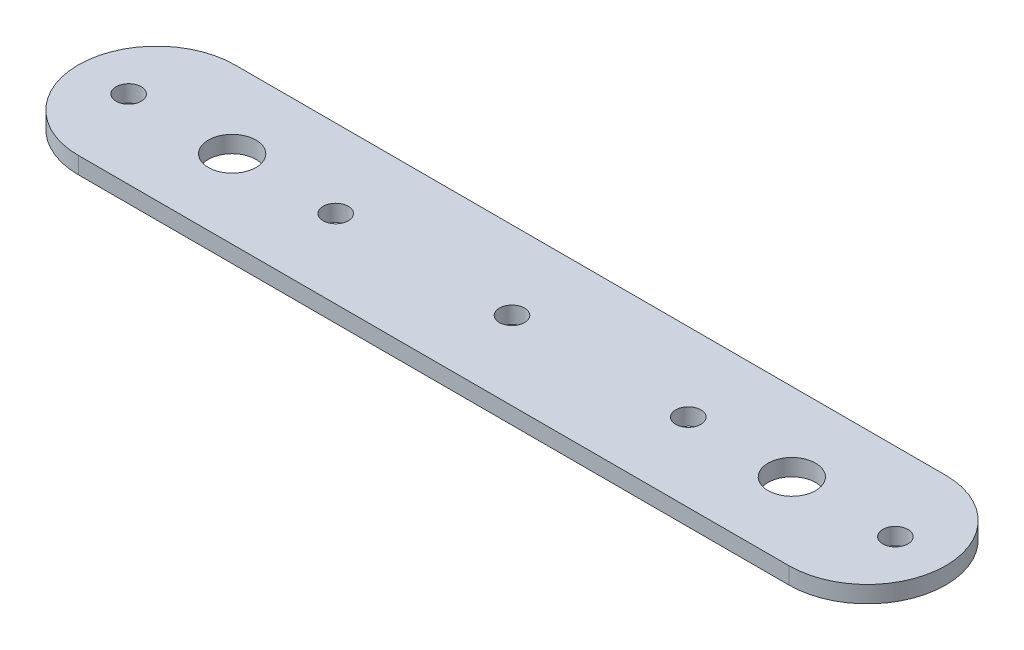
from build123d import *

# Parameters (mm, degrees)
SKETCH_1_W          = 155
SKETCH_1_H          = 28
EXTRUDE_1_DEPTH     = 3
CUT_EXTRUDE_1_REACH = 80.811
SKETCH_2_R          = 4.25
SKETCH_2_R_2        = 2.25
FILLET_1_RADIUS     = 14
FILLET_1_LENGTH     = 3
CUT_EXTRUDE_2_REACH = 80.811
SKETCH_3_R          = 2.25
FILLET_2_RADIUS     = 14
FILLET_2_LENGTH     = 3


with BuildPart() as part:
    # 草图1 → 凸台-拉伸1 (new body)
    with BuildSketch(Plane(origin=(0, 0, 0), x_dir=(1, 0, 0), z_dir=(0, 1, 0))):
        Rectangle(SKETCH_1_W, SKETCH_1_H)
    extrude(amount=EXTRUDE_1_DEPTH)

    # 草图2 → 切除-拉伸1 (cut, up to next)
    with BuildSketch(Plane(origin=(0, 3, 0), x_dir=(1, 0, 0), z_dir=(0, 1, 0)), mode=Mode.PRIVATE) as cut_extrude_1_sk1:
        with Locations(Location((-50, 0, 0), (0, 0, 270))):
            Circle(SKETCH_2_R)
    cut_extrude_1_tool1 = extrude(cut_extrude_1_sk1.sketch, amount=-CUT_EXTRUDE_1_REACH, mode=Mode.PRIVATE) & part.part
    # 草图2 → 切除-拉伸1 (cut, up to next)
    with BuildSketch(Plane(origin=(0, 3, 0), x_dir=(1, 0, 0), z_dir=(0, 1, 0)), mode=Mode.PRIVATE) as cut_extrude_1_sk2:
        with Locations(Location((50, 0, 0), (0, 0, 270))):
            Circle(SKETCH_2_R)
    cut_extrude_1_tool2 = extrude(cut_extrude_1_sk2.sketch, amount=-CUT_EXTRUDE_1_REACH, mode=Mode.PRIVATE) & part.part
    # 草图2 → 切除-拉伸1 (cut, up to next)
    with BuildSketch(Plane(origin=(0, 3, 0), x_dir=(1, 0, 0), z_dir=(0, 1, 0)), mode=Mode.PRIVATE) as cut_extrude_1_sk3:
        with Locations(Location((0, 0, 0), (0, 0, 270))):
            Circle(SKETCH_2_R_2)
    cut_extrude_1_tool3 = extrude(cut_extrude_1_sk3.sketch, amount=-CUT_EXTRUDE_1_REACH, mode=Mode.PRIVATE) & part.part
    add(cut_extrude_1_tool1.solids().sort_by_distance((-50, 3, 0))[0], mode=Mode.SUBTRACT)
    add(cut_extrude_1_tool2.solids().sort_by_distance((50, 3, 0))[0], mode=Mode.SUBTRACT)
    add(cut_extrude_1_tool3.solids().sort_by_distance((0, 3, 0))[0], mode=Mode.SUBTRACT)

    # 圆角1: full round fillet: the end face becomes a half cylinder, R = half its width
    fillet_1_face = Plane((-77.5, 1.5, 0), x_dir=(0, 1, 0), z_dir=(-1, 0, 0))  # on the end face: x along it, z out of the body
    fillet_1_slab = fillet_1_face.offset(-FILLET_1_RADIUS / 2) * Box(FILLET_1_LENGTH, 2 * FILLET_1_RADIUS, FILLET_1_RADIUS, mode=Mode.PRIVATE)  # the body's end, R deep
    fillet_1_round = Plane((-63.5, 1.5, 0), x_dir=(-1, 0, 0), z_dir=(0, 1, 0)) * Cylinder(FILLET_1_RADIUS, FILLET_1_LENGTH, mode=Mode.PRIVATE)  # its axis R under the face
    add(fillet_1_slab - fillet_1_round, mode=Mode.SUBTRACT)

    # 草图3 → 切除-拉伸2 (cut, up to next)
    with BuildSketch(Plane(origin=(0, 3, 0), x_dir=(1, 0, 0), z_dir=(0, 1, 0)), mode=Mode.PRIVATE) as cut_extrude_2_sk1:
        with Locations(Location((-68.5, 0, 0), (0, 0, 270))):
            Circle(SKETCH_3_R)
    cut_extrude_2_tool1 = extrude(cut_extrude_2_sk1.sketch, amount=-CUT_EXTRUDE_2_REACH, mode=Mode.PRIVATE) & part.part
    # 草图3 → 切除-拉伸2 (cut, up to next)
    with BuildSketch(Plane(origin=(0, 3, 0), x_dir=(1, 0, 0), z_dir=(0, 1, 0)), mode=Mode.PRIVATE) as cut_extrude_2_sk2:
        with Locations(Location((-31.5, 0, 0), (0, 0, 270))):
            Circle(SKETCH_3_R)
    cut_extrude_2_tool2 = extrude(cut_extrude_2_sk2.sketch, amount=-CUT_EXTRUDE_2_REACH, mode=Mode.PRIVATE) & part.part
    # 草图3 → 切除-拉伸2 (cut, up to next)
    with BuildSketch(Plane(origin=(0, 3, 0), x_dir=(1, 0, 0), z_dir=(0, 1, 0)), mode=Mode.PRIVATE) as cut_extrude_2_sk3:
        with Locations(Location((31.5, 0, 0), (0, 0, 270))):
            Circle(SKETCH_3_R)
    cut_extrude_2_tool3 = extrude(cut_extrude_2_sk3.sketch, amount=-CUT_EXTRUDE_2_REACH, mode=Mode.PRIVATE) & part.part
    # 草图3 → 切除-拉伸2 (cut, up to next)
    with BuildSketch(Plane(origin=(0, 3, 0), x_dir=(1, 0, 0), z_dir=(0, 1, 0)), mode=Mode.PRIVATE) as cut_extrude_2_sk4:
        with Locations(Location((68.5, 0, 0), (0, 0, 270))):
            Circle(SKETCH_3_R)
    cut_extrude_2_tool4 = extrude(cut_extrude_2_sk4.sketch, amount=-CUT_EXTRUDE_2_REACH, mode=Mode.PRIVATE) & part.part
    add(cut_extrude_2_tool1.solids().sort_by_distance((-68.5, 3, 0))[0], mode=Mode.SUBTRACT)
    add(cut_extrude_2_tool2.solids().sort_by_distance((-31.5, 3, 0))[0], mode=Mode.SUBTRACT)
    add(cut_extrude_2_tool3.solids().sort_by_distance((31.5, 3, 0))[0], mode=Mode.SUBTRACT)
    add(cut_extrude_2_tool4.solids().sort_by_distance((68.5, 3, 0))[0], mode=Mode.SUBTRACT)

    # 圆角2: full round fillet: the end face becomes a half cylinder, R = half its width
    fillet_2_face = Plane((77.5, 1.5, 0), x_dir=(0, -1, 0), z_dir=(1, 0, 0))  # on the end face: x along it, z out of the body
    fillet_2_slab = fillet_2_face.offset(-FILLET_2_RADIUS / 2) * Box(FILLET_2_LENGTH, 2 * FILLET_2_RADIUS, FILLET_2_RADIUS, mode=Mode.PRIVATE)  # the body's end, R deep
    fillet_2_round = Plane((63.5, 1.5, 0), x_dir=(1, 0, 0), z_dir=(0, -1, 0)) * Cylinder(FILLET_2_RADIUS, FILLET_2_LENGTH, mode=Mode.PRIVATE)  # its axis R under the face
    add(fillet_2_slab - fillet_2_round, mode=Mode.SUBTRACT)


solid = part.part
